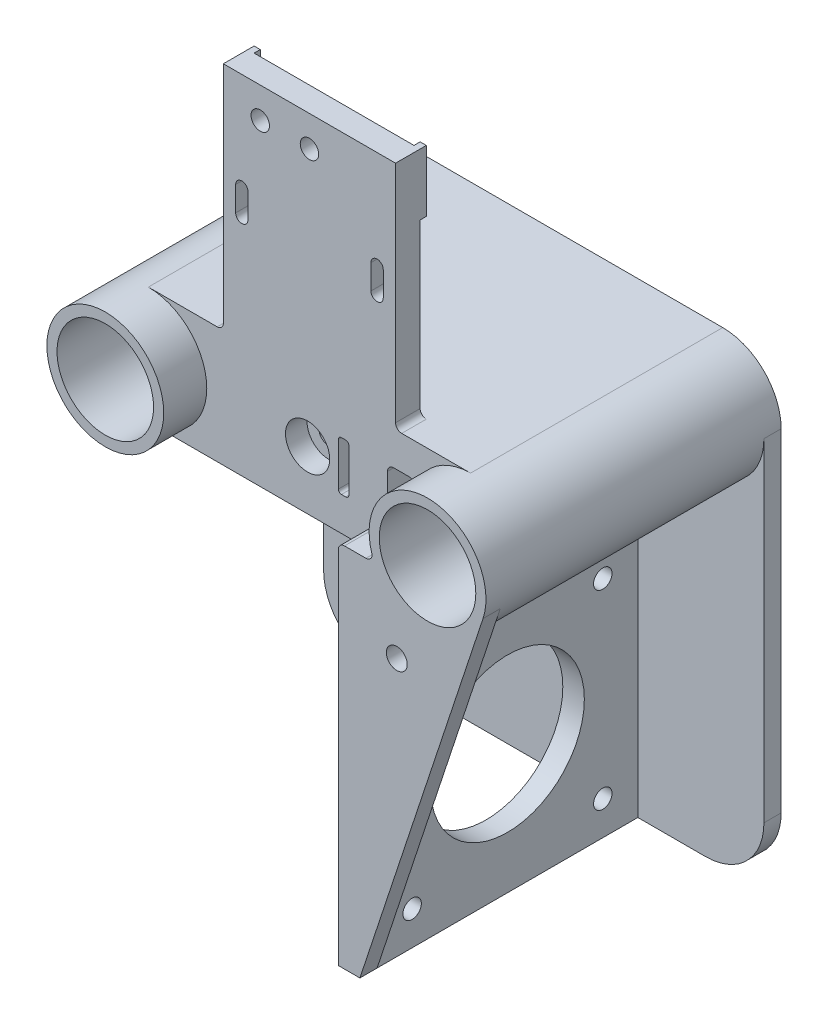
from build123d import *

# Parameters (mm, degrees)
SKETCH1_R             = 9.5
SKETCH1_R_2           = 7.85
BOSS_EXTRUDE1_DEPTH   = 48
BOSS_EXTRUDE1_2_DEPTH = 48
SKETCH29_R            = 1.5
BOSS_EXTRUDE18_DEPTH  = 3
SKETCH36_R            = 1.7
BOSS_EXTRUDE26_DEPTH  = 38
SKETCH14_R            = 4.125
BOSS_EXTRUDE27_DEPTH  = 4
SKETCH34_R            = 4.2
CUT_EXTRUDE17_DEPTH   = 4.5
SKETCH38_R            = 2.15
CUT_EXTRUDE18_DEPTH   = 18.5
BOSS_EXTRUDE43_DEPTH  = 42.2
SKETCH7_R             = 1.7
BOSS_EXTRUDE44_DEPTH  = 2.8
BOSS_EXTRUDE42_START  = 25
BOSS_EXTRUDE42_DEPTH  = 6.5
BOSS_EXTRUDE45_DEPTH  = 10
SKETCH47_R            = 4
SKETCH47_R_2          = 1.5
BOSS_EXTRUDE40_DEPTH  = 1.4
CUT_EXTRUDE19_START   = -3.5
SKETCH20_R            = 1.5
SKETCH20_R_2          = 12.5
CUT_EXTRUDE19_DEPTH   = 3.5
SKETCH43_R            = 3.6
CUT_EXTRUDE22_DEPTH   = 3.5
BOSS_EXTRUDE38_DEPTH  = 4
SKETCH52_W            = 1
SKETCH52_H            = 10
BOSS_EXTRUDE36_DEPTH  = 1
SKETCH53_R            = 1.5
CUT_EXTRUDE29_DEPTH   = 4
CUT_EXTRUDE30_START   = -0.2
CUT_EXTRUDE30_DEPTH   = 0.2
CUT_EXTRUDE33_DEPTH   = 25
CUT_EXTRUDE32_DEPTH   = 8


with BuildPart() as part:
    # Sketch1 → Boss-Extrude1 (new body)
    with BuildSketch(Plane.XY):
        Circle(SKETCH1_R)
        Circle(SKETCH1_R_2, mode=Mode.SUBTRACT)
    extrude(amount=BOSS_EXTRUDE1_DEPTH)



with BuildPart() as body_2:
    # Sketch1 → Boss-Extrude1 2 (new body)
    with BuildSketch(Plane.XY):
        with Locations((52.4, 0)):
            Circle(SKETCH1_R)
        with Locations((52.4, 0)):
            Circle(SKETCH1_R_2, mode=Mode.SUBTRACT)
    extrude(amount=BOSS_EXTRUDE1_2_DEPTH)


with BuildPart() as part_1:
    add(part.part)

    add(body_2.part)  # Boss-Extrude18 merges body 2
    # Sketch29 → Boss-Extrude18 (add)
    with BuildSketch(Plane(origin=(0, 0, 0), x_dir=(-1, 0, 0), z_dir=(0, 0, -1))):
        with BuildLine():
            Line((-52.4, 9.5), (0, 9.5))
            ThreePointArc((0, 9.5), (-6.717514421, -6.717514421), (9.5, 0))
            Line((9.5, 0), (9.5, -54.1))
            ThreePointArc((9.5, -54.1), (6.717514421, -60.817514421), (0, -63.6))
            Line((0, -63.6), (-52.4, -63.6))
            ThreePointArc((-52.4, -63.6), (-59.117514421, -60.817514421), (-61.9, -54.1))
            Line((-61.9, -54.1), (-61.9, 0))
            ThreePointArc((-61.9, 0), (-53.919565268, -9.377682091), (-43.386121811, -3))
            ThreePointArc((-43.386121811, -3), (-43.093228593, -3.707106781), (-42.386121811, -4))
            Line((-42.386121811, -4), (-39.9, -4))
            ThreePointArc((-39.9, -4), (-39.192893219, -3.707106781), (-38.9, -3))
            Line((-38.9, -3), (-38.9, 3))
            ThreePointArc((-38.9, 3), (-39.192893219, 3.707106781), (-39.9, 4))
            Line((-39.9, 4), (-42.386121811, 4))
            ThreePointArc((-42.386121811, 4), (-43.093228593, 3.707106781), (-43.386121811, 3))
            ThreePointArc((-43.386121811, 3), (-46.843472307, 7.705517504), (-52.4, 9.5))
        make_face()
        with Locations(Location((-3.3, -36.55, 0), (0, 0, 180))):
            Circle(SKETCH29_R, mode=Mode.SUBTRACT)
        with Locations(Location((-17.3, -36.55, 0), (0, 0, 180))):
            Circle(SKETCH29_R, mode=Mode.SUBTRACT)
    extrude(amount=-BOSS_EXTRUDE18_DEPTH)

    # Sketch36 → Boss-Extrude26 (add)
    with BuildSketch(Plane.XY.offset(3)):
        with BuildLine():
            Line((0, 9.5), (52.4, 9.5))
            ThreePointArc((52.4, 9.5), (46.843472307, 7.705517504), (43.386121811, 3))
            ThreePointArc((43.386121811, 3), (43.093228593, 3.707106781), (42.386121811, 4))
            Line((42.386121811, 4), (39.9, 4))
            ThreePointArc((39.9, 4), (39.192893219, 3.707106781), (38.9, 3))
            Line((38.9, 3), (38.9, -3))
            ThreePointArc((38.9, -3), (39.192893219, -3.707106781), (39.9, -4))
            Line((39.9, -4), (42.386121811, -4))
            ThreePointArc((42.386121811, -4), (43.093228593, -3.707106781), (43.386121811, -3))
            ThreePointArc((43.386121811, -3), (46.843472307, -7.705517504), (52.4, -9.5))
            Line((52.4, -9.5), (0, -9.5))
            ThreePointArc((0, -9.5), (9.5, 0), (0, 9.5))
        make_face()
        with Locations(Location((25.9, 0, 0), (0, 0, 180))):
            Circle(SKETCH36_R, mode=Mode.SUBTRACT)
        with BuildLine():
            Line((31.4, 4), (32.1, 4))
            ThreePointArc((32.1, 4), (32.453553391, 3.853553391), (32.6, 3.5))
            Line((32.6, 3.5), (32.6, -3.5))
            ThreePointArc((32.6, -3.5), (32.453553391, -3.853553391), (32.1, -4))
            Line((32.1, -4), (31.4, -4))
            ThreePointArc((31.4, -4), (31.046446609, -3.853553391), (30.9, -3.5))
            Line((30.9, -3.5), (30.9, 3.5))
            ThreePointArc((30.9, 3.5), (31.046446609, 3.853553391), (31.4, 4))
        make_face(mode=Mode.SUBTRACT)
    extrude(amount=BOSS_EXTRUDE26_DEPTH)

    # Sketch14 → Boss-Extrude27 (add)
    with BuildSketch(Plane.XZ.offset(9.5)):
        with Locations(Location((14.4, 28.5, 0), (0, 0, 180))):
            Circle(SKETCH14_R)
    extrude(amount=BOSS_EXTRUDE27_DEPTH)

    # Sketch34 → Cut-Extrude17 (cut)
    with BuildSketch(Plane(origin=(0, 9.5, 0), x_dir=(1, 0, 0), z_dir=(0, 1, 0))):
        with Locations(Location((14.4, -28.5, 0), (0, 0, 180))):
            Circle(SKETCH34_R)
    extrude(amount=-CUT_EXTRUDE17_DEPTH, mode=Mode.SUBTRACT)

    # Sketch38 → Cut-Extrude18 (cut)
    with BuildSketch(Plane(origin=(0, 5, 0), x_dir=(1, 0, 0), z_dir=(0, 1, 0))):
        with Locations(Location((14.5, -28.5, 0), (0, 0, 270))):
            Circle(SKETCH38_R)
    extrude(amount=-CUT_EXTRUDE18_DEPTH, mode=Mode.SUBTRACT)

    # Sketch39 → Boss-Extrude43 (add)
    with BuildSketch(Plane.XY.offset(3)):
        with BuildLine():
            Line((41.4, -63.6), (37.9, -63.6))
            Line((37.9, -63.6), (37.9, -5))
            ThreePointArc((37.9, -5), (38.192893219, -4.292893219), (38.9, -4))
            Line((38.9, -4), (42.386121811, -4))
            ThreePointArc((42.386121811, -4), (43.093228593, -3.707106781), (43.386121811, -3))
            ThreePointArc((43.386121811, -3), (46.843472307, -7.705517504), (52.4, -9.5))
            Line((52.4, -9.5), (41.4, -9.5))
            Line((41.4, -9.5), (41.4, -63.6))
        make_face()
    extrude(amount=BOSS_EXTRUDE43_DEPTH)

    # Sketch7 → Boss-Extrude44 (add)
    with BuildSketch(Plane.XY.offset(45.2)):
        with BuildLine():
            Line((38.9, -4), (42.386121811, -4))
            ThreePointArc((42.386121811, -4), (43.093228593, -3.707106781), (43.386121811, -3))
            ThreePointArc((43.386121811, -3), (52.410945742, -9.499993694), (61.420767352, -2.979220768))
            Line((61.420767352, -2.979220768), (41.4, -63.6))
            Line((41.4, -63.6), (37.9, -63.6))
            Line((37.9, -63.6), (37.9, -5))
            ThreePointArc((37.9, -5), (38.192893219, -4.292893219), (38.9, -4))
        make_face()
        with Locations(Location((47.4, -15.6, 0), (0, 0, 180))):
            Circle(SKETCH7_R, mode=Mode.SUBTRACT)
    extrude(amount=BOSS_EXTRUDE44_DEPTH)

    # Sketch69 → Boss-Extrude42 (add)
    with BuildSketch(Plane.ZY.offset(-37.9).offset(BOSS_EXTRUDE42_START)):
        Polygon((3, -9.5), (3, -25), (18.5, -9.5), align=None)
    extrude(amount=BOSS_EXTRUDE42_DEPTH)

    # Sketch40 → Boss-Extrude45 (add)
    with BuildSketch(Plane(origin=(0, 0, 45.2), x_dir=(-1, 0, 0), z_dir=(0, 0, -1))):
        with BuildLine():
            Line((-42.2, -12.85), (-41.4, -12.85))
            Line((-41.4, -12.85), (-41.4, -18.15))
            Line((-41.4, -18.15), (-42.2, -18.15))
            ThreePointArc((-42.2, -18.15), (-42.553553391, -18.003553391), (-42.7, -17.65))
            Line((-42.7, -17.65), (-42.7, -13.35))
            ThreePointArc((-42.7, -13.35), (-42.553553391, -12.996446609), (-42.2, -12.85))
        make_face()
    extrude(amount=BOSS_EXTRUDE45_DEPTH)

    # Sketch47 → Boss-Extrude40 (add)
    with BuildSketch(Plane(origin=(41.4, 0, 0), x_dir=(0, 0, -1), z_dir=(1, 0, 0))):
        with Locations(Location((-8.5, -15.55, 0), (0, 0, 180))):
            Circle(SKETCH47_R)
        with Locations((-8.5, -15.55)):
            Circle(SKETCH47_R_2, mode=Mode.SUBTRACT)
    extrude(amount=BOSS_EXTRUDE40_DEPTH)

    # Sketch20 → Cut-Extrude19 (cut)
    with BuildSketch(Plane(origin=(41.4, 0, 0), x_dir=(0, 0, -1), z_dir=(1, 0, 0)).offset(CUT_EXTRUDE19_START)):
        with Locations((-8.5, -58.1)):
            Circle(SKETCH20_R)
        with Locations((-39.5, -58.1)):
            Circle(SKETCH20_R)
        with Locations((-8.5, -27.1)):
            Circle(SKETCH20_R)
        with Locations((-24, -42.6)):
            Circle(SKETCH20_R_2)
        with Locations(Location((-8.5, -15.55, 0), (0, 0, 90))):
            Circle(SKETCH20_R)
    extrude(amount=CUT_EXTRUDE19_DEPTH, mode=Mode.SUBTRACT)

    # Sketch43 → Cut-Extrude22 (cut)
    with BuildSketch(Plane.XY.offset(41)):
        with Locations((25.9, 0)):
            Circle(SKETCH43_R)
    extrude(amount=-CUT_EXTRUDE22_DEPTH, mode=Mode.SUBTRACT)

    # Sketch59 → Boss-Extrude38 (add)
    with BuildSketch(Plane.XY.offset(41)):
        with BuildLine():
            Line((11.2, 9.5), (41.2, 9.5))
            ThreePointArc((41.2, 9.5), (40.492893219, 9.792893219), (40.2, 10.5))
            Line((40.2, 10.5), (40.2, 47.05))
            Line((40.2, 47.05), (12.2, 47.05))
            Line((12.2, 47.05), (12.2, 10.5))
            ThreePointArc((12.2, 10.5), (11.907106781, 9.792893219), (11.2, 9.5))
        make_face()
    extrude(amount=-BOSS_EXTRUDE38_DEPTH)

    # Sketch52 → Boss-Extrude36 (add)
    with BuildSketch(Plane(origin=(-30, 0, 37), x_dir=(-1, 0, 0), z_dir=(0, 0, -1))):
        with Locations((-69.7, 42.05)):
            Rectangle(SKETCH52_W, SKETCH52_H)
        with Locations((-42.7, 42.05)):
            Rectangle(SKETCH52_W, SKETCH52_H)
    extrude(amount=BOSS_EXTRUDE36_DEPTH)

    # Sketch53 → Cut-Extrude29 (cut)
    with BuildSketch(Plane(origin=(-30, 0, 37), x_dir=(-1, 0, 0), z_dir=(0, 0, -1))):
        with Locations((-48.2, 42.05)):
            Circle(SKETCH53_R)
        with Locations((-56.2, 42.05)):
            Circle(SKETCH53_R)
        with BuildLine():
            Line((-68.2, 31.05), (-68.2, 27.05))
            ThreePointArc((-68.2, 27.05), (-67.2, 26.05), (-66.2, 27.05))
            Line((-66.2, 27.05), (-66.2, 31.05))
            ThreePointArc((-66.2, 31.05), (-67.2, 32.05), (-68.2, 31.05))
        make_face()
        with BuildLine():
            Line((-46.2, 31.05), (-46.2, 27.05))
            ThreePointArc((-46.2, 27.05), (-45.2, 26.05), (-44.2, 27.05))
            Line((-44.2, 27.05), (-44.2, 31.05))
            ThreePointArc((-44.2, 31.05), (-45.2, 32.05), (-46.2, 31.05))
        make_face()
    extrude(amount=-CUT_EXTRUDE29_DEPTH, mode=Mode.SUBTRACT)

    # Sketch62 → Cut-Extrude30 (cut)
    with BuildSketch(Plane.XY.offset(3).offset(CUT_EXTRUDE30_START)):
        with BuildLine():
            Line((61.9, -54.1), (61.9, 0))
            ThreePointArc((61.9, 0), (59.117514421, -6.717514421), (52.4, -9.5))
            Line((52.4, -9.5), (41.4, -9.5))
            Line((41.4, -9.5), (41.4, -63.6))
            Line((41.4, -63.6), (52.4, -63.6))
            ThreePointArc((52.4, -63.6), (59.117514421, -60.817514421), (61.9, -54.1))
        make_face()
    extrude(amount=CUT_EXTRUDE30_DEPTH, mode=Mode.SUBTRACT)

    # Sketch70 → Cut-Extrude33 (cut)
    with BuildSketch(Plane(origin=(0, 0, 0), x_dir=(-1, 0, 0), z_dir=(0, 0, -1))):
        with BuildLine():
            Line((-33.9, -6.5), (-22.9, -6.5))
            ThreePointArc((-22.9, -6.5), (-21.485786438, -5.914213562), (-20.9, -4.5))
            Line((-20.9, -4.5), (-20.9, 4.5))
            ThreePointArc((-20.9, 4.5), (-21.485786438, 5.914213562), (-22.9, 6.5))
            Line((-22.9, 6.5), (-33.9, 6.5))
            ThreePointArc((-33.9, 6.5), (-35.314213562, 5.914213562), (-35.9, 4.5))
            Line((-35.9, 4.5), (-35.9, -4.5))
            ThreePointArc((-35.9, -4.5), (-35.314213562, -5.914213562), (-33.9, -6.5))
        make_face()
    extrude(amount=-CUT_EXTRUDE33_DEPTH, mode=Mode.SUBTRACT)

    # Sketch66 → Cut-Extrude32 (cut)
    with BuildSketch(Plane(origin=(0, 0, 25), x_dir=(-1, 0, 0), z_dir=(0, 0, -1))):
        with BuildLine():
            Line((-31.4, 4), (-32.9, 4))
            ThreePointArc((-32.9, 4), (-33.253553391, 3.853553391), (-33.4, 3.5))
            Line((-33.4, 3.5), (-33.4, -3.5))
            ThreePointArc((-33.4, -3.5), (-33.253553391, -3.853553391), (-32.9, -4))
            Line((-32.9, -4), (-31.4, -4))
            ThreePointArc((-31.4, -4), (-31.046446609, -3.853553391), (-30.9, -3.5))
            Line((-30.9, -3.5), (-30.9, 3.5))
            ThreePointArc((-30.9, 3.5), (-31.046446609, 3.853553391), (-31.4, 4))
        make_face()
    extrude(amount=-CUT_EXTRUDE32_DEPTH, mode=Mode.SUBTRACT)


solid = part_1.part
